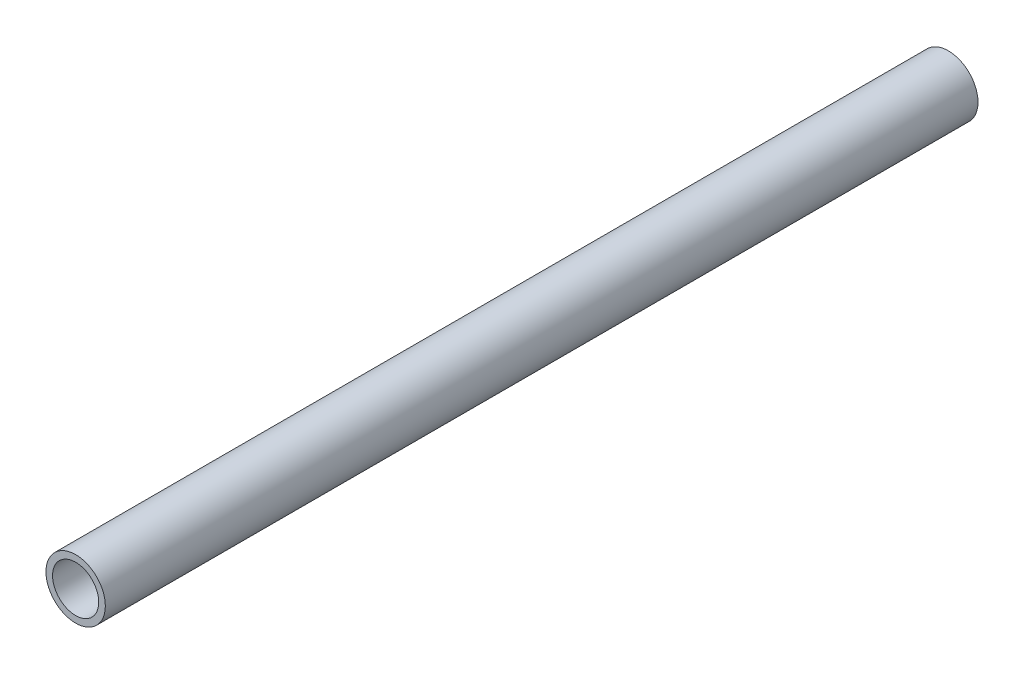
from build123d import *

# Parameters (mm, degrees)
SKETCH1_R           = 9
SKETCH1_R_2         = 7
BOSS_EXTRUDE1_DEPTH = 264.45


with BuildPart() as part:
    # Sketch1 → Boss-Extrude1 (new body)
    with BuildSketch(Plane.XY):
        Circle(SKETCH1_R)
        Circle(SKETCH1_R_2, mode=Mode.SUBTRACT)
    extrude(amount=BOSS_EXTRUDE1_DEPTH)


solid = part.part
